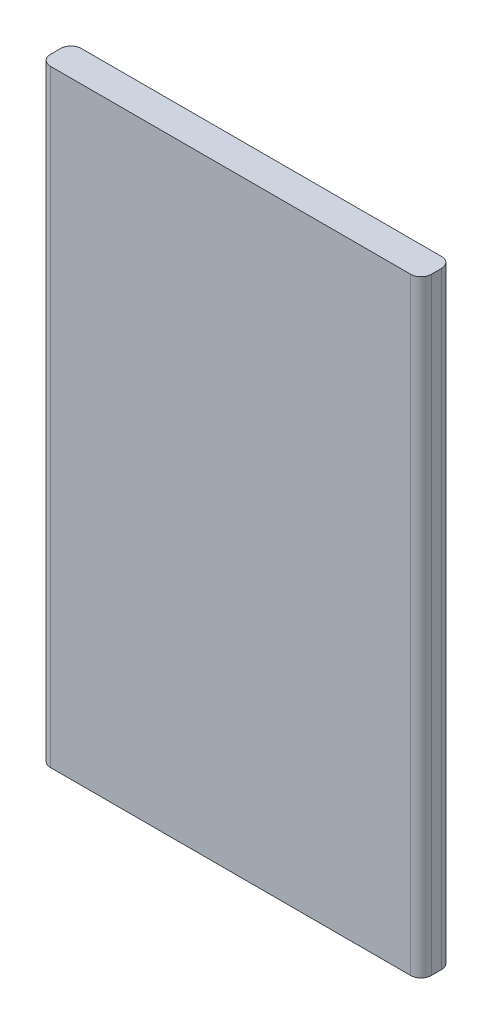
from build123d import *

# Parameters (mm, degrees)
SKETCH1_W           = 37
SKETCH1_H           = 59
BOSS_EXTRUDE1_DEPTH = 3
FILLET1_R           = 1


with BuildPart() as part:
    # Sketch1 → Boss-Extrude1 (new body)
    with BuildSketch(Plane.XY):
        Rectangle(SKETCH1_W, SKETCH1_H)
    extrude(amount=BOSS_EXTRUDE1_DEPTH)

    # Fillet1
    fillet1_edges = [part.edges().sort_by_distance(p)[0] for p in [
        (-18.5, 0, 3),
        (18.5, 0, 3),
        (-18.5, 0, 0),
        (18.5, 0, 0),
    ]]
    fillet(fillet1_edges, radius=FILLET1_R)


solid = part.part
